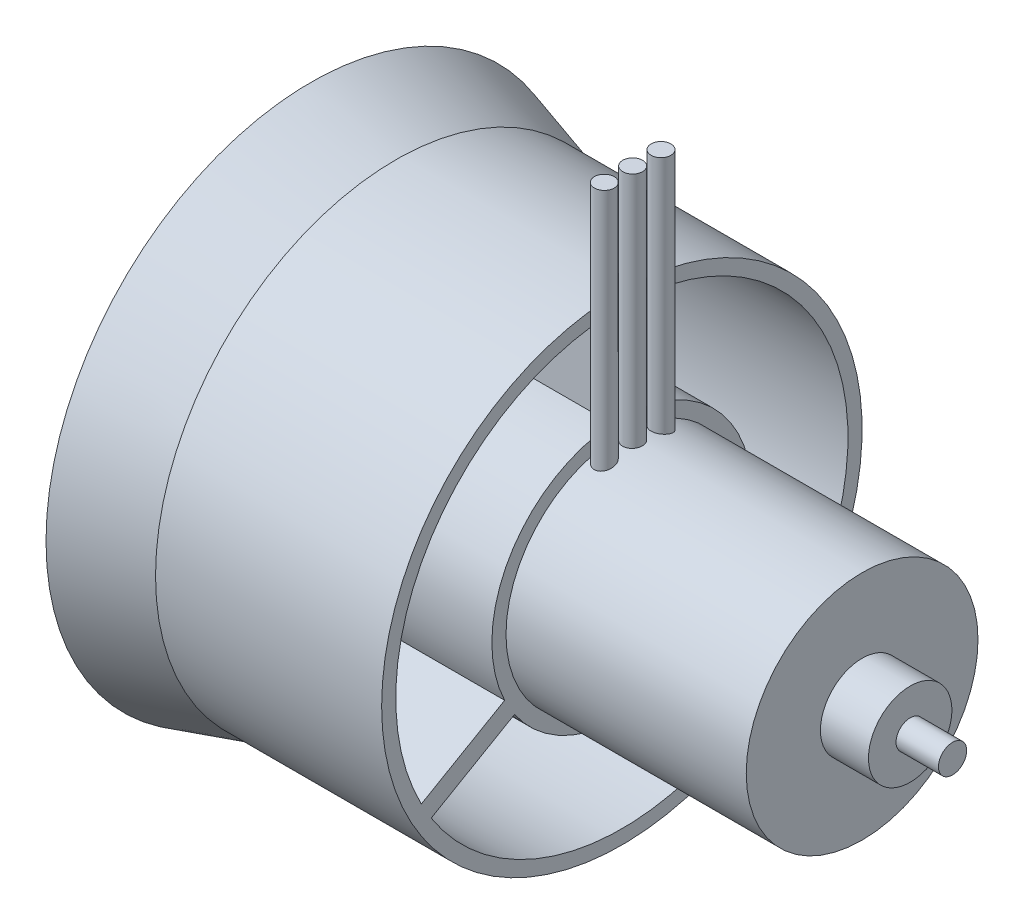
from build123d import *

# Parameters (mm, degrees)
ENL_V_MAT_EXTRU_1_DEPTH      = 38.559086783
R_P_TITION_CIRCULAIRE1_COUNT = 3
ESQUISSE5_R                  = 0.7
BOSS_EXTRU_1_DEPTH           = 25


with BuildPart() as part:
    # Esquisse1 → Révolution1 (revolve)
    with BuildSketch(Plane.XY):
        Polygon((0, 0), (50, 0), (50, 1), (47, 1), (47, 2.95), (43.6, 2.95), (43.6, 8.2), (26.6, 8.2), (26.6, 17), (10.6, 17), (4.6, 18.75), (4.6, 5.75), (0, 3.370541895), align=None)
    revolve(axis=Axis((0, 0, 0), (1, 0, 0)))

    # Esquisse4 → Enlèv. mat.-Extru.1 (cut, through all)
    with BuildSketch(Plane(origin=(26.6, 0, 0), x_dir=(0, 0, -1), z_dir=(1, 0, 0))):
        with BuildLine():
            Line((-0.7, 15.984680166), (-0.7, 9.173330911))
            ThreePointArc((-0.7, 9.173330911), (-7.967433715, 4.6), (-8.294337606, -3.980447673))
            Line((-8.294337606, -3.980447673), (-14.193139095, -7.3861223))
            ThreePointArc((-14.193139095, -7.3861223), (-13.856406461, 8), (-0.7, 15.984680166))
        make_face()
    enl_v_mat_extru_1 = extrude(amount=-ENL_V_MAT_EXTRU_1_DEPTH, mode=Mode.SUBTRACT)

    # Répétition circulaire1: Enlèv. mat.-Extru.1 ×3 about axis
    r_p_tition_circulaire1_axis = Axis((45.207157615, 0, 0), (-1, 0, 0))
    for i in range(1, R_P_TITION_CIRCULAIRE1_COUNT):
        add(enl_v_mat_extru_1.rotate(r_p_tition_circulaire1_axis, i * 360 / R_P_TITION_CIRCULAIRE1_COUNT), mode=Mode.SUBTRACT)

    # Esquisse5 → Boss.-Extru.1 (add)
    with BuildSketch(Plane(origin=(0, 0, 0), x_dir=(1, 0, 0), z_dir=(0, 1, 0))):
        with Locations((27.361357126, 0)):
            Circle(ESQUISSE5_R)
        with Locations((27.361357126, 2.007154896)):
            Circle(ESQUISSE5_R)
        with Locations((27.361357126, -2.007154896)):
            Circle(ESQUISSE5_R)
    extrude(amount=BOSS_EXTRU_1_DEPTH)


solid = part.part
